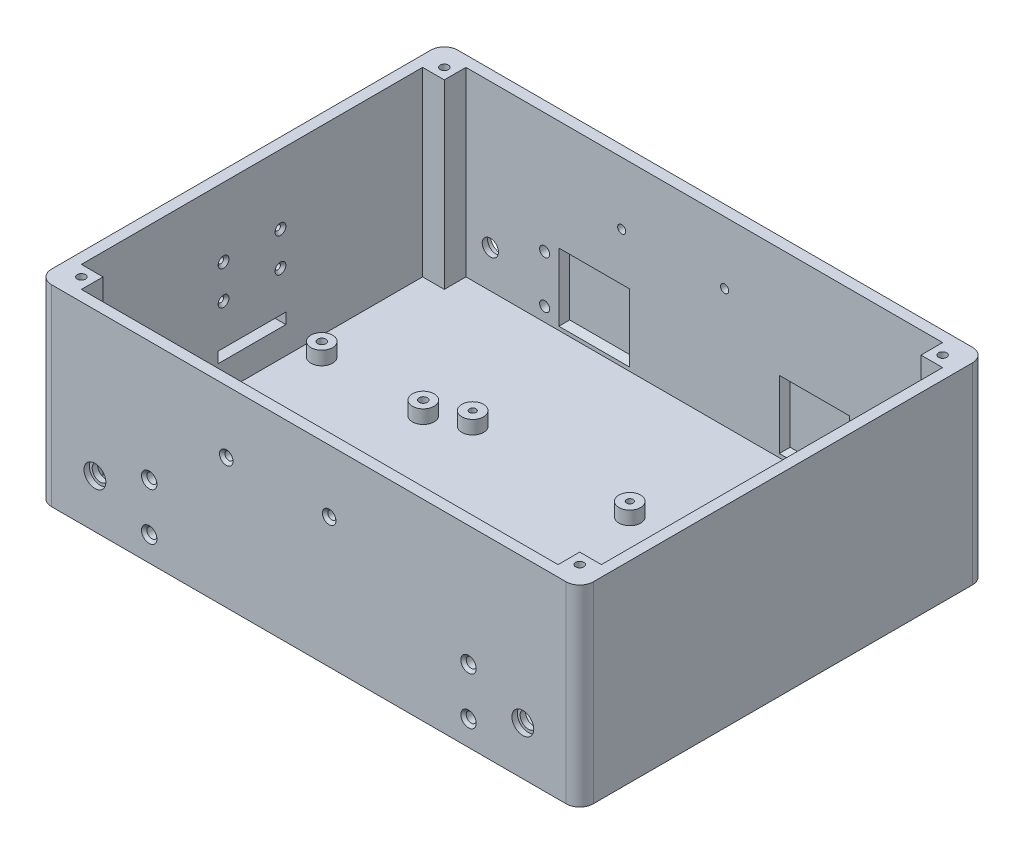
from build123d import *

# Parameters (mm, degrees)
SZKIC2_W                        = 200
SZKIC2_H                        = 150
DODANIE_WYCI_GNI_CIE1_DEPTH     = 41
SKORUPA1_T                      = -4
WYTNIJ_WYCI_GNI_CIE2_DEPTH      = 167
WYTNIJ_WYCI_GNI_CIE2_DEPTH_BACK = 15
SZKIC3_R                        = 3
SZKIC3_R_2                      = 1.85
SZKIC4_R                        = 4.035
WYTNIJ_WYCI_GNI_CIE3_DEPTH      = 2
WYTNIJ_WYCI_GNI_CIE4_START      = -2
SZKIC5_R                        = 4.035
WYTNIJ_WYCI_GNI_CIE4_DEPTH      = 2
SZKIC6_R                        = 4
DODANIE_WYCI_GNI_CIE2_DEPTH     = 5
SZKIC7_R                        = 1.2
WYTNIJ_WYCI_GNI_CIE5_DEPTH      = 10
SZKIC9_W                        = 26
SZKIC9_H                        = 25
WYTNIJ_WYCI_GNI_CIE7_DEPTH      = 2
WYTNIJ_WYCI_GNI_CIE7_DRAFT      = -45
SZKIC10_W                       = 26
SZKIC10_H                       = 25
WYTNIJ_WYCI_GNI_CIE8_DEPTH      = 2
WYTNIJ_WYCI_GNI_CIE8_DRAFT      = -45
SZKIC11_W                       = 26
SZKIC11_H                       = 25
WYTNIJ_WYCI_GNI_CIE9_DEPTH      = 2
WYTNIJ_WYCI_GNI_CIE9_DRAFT      = -45
SZKIC12_W                       = 26
SZKIC12_H                       = 25
WYTNIJ_WYCI_GNI_CIE10_DEPTH     = 2
WYTNIJ_WYCI_GNI_CIE10_DRAFT     = -45
SZKIC13_R                       = 4
DODANIE_WYCI_GNI_CIE3_DEPTH     = 5
SZKIC14_R                       = 1.5
WYTNIJ_WYCI_GNI_CIE11_DEPTH     = 20
SZKIC15_W                       = 200
SZKIC15_H                       = 150
SZKIC15_W_2                     = 192
SZKIC15_H_2                     = 142
DODANIE_WYCI_GNI_CIE4_DEPTH     = 30
SZKIC18_R                       = 1.5
WYTNIJ_WYCI_GNI_CIE12_DEPTH     = 170
SFAZOWANIE4_SIZE                = 1
ZAOKR_GLENIE2_R                 = 5
ZAOKR_GLENIE3_R                 = 5
ZAOKR_GLENIE4_R                 = 5
ZAOKR_GLENIE5_R                 = 5
SZKIC20_W                       = 25
SZKIC20_H                       = 4
WYTNIJ_WYCI_GNI_CIE13_DEPTH     = 10
SZKIC21_W                       = 8
SZKIC21_H                       = 8
SZKIC21_R                       = 1.5
DODANIE_WYCI_GNI_CIE5_DEPTH     = 67
SZKIC22_R                       = 4
DODANIE_WYCI_GNI_CIE6_DEPTH     = 5
SZKIC23_R                       = 1.5
WYTNIJ_WYCI_GNI_CIE14_DEPTH     = 10
SZKIC24_R                       = 1
WYTNIJ_WYCI_GNI_CIE15_DEPTH     = 5
SFAZOWANIE5_SIZE                = 1


with BuildPart() as part:
    # Szkic2 → Dodanie-wyciągnięcie1 (new body)
    with BuildSketch(Plane(origin=(0, 0, 0), x_dir=(1, 0, 0), z_dir=(0, 1, 0))):
        Rectangle(SZKIC2_W, SZKIC2_H)
    extrude(amount=DODANIE_WYCI_GNI_CIE1_DEPTH)

    # Skorupa1
    skorupa1_openings = [part.faces().sort_by_distance(p)[0] for p in [
        (0, 41, 0),
    ]]
    offset(amount=SKORUPA1_T, openings=skorupa1_openings, kind=Kind.INTERSECTION)

    # Szkic3 → Wytnij-wyciągnięcie2 (cut, two sides: drawn at the far end of the back side and taken through both)
    with BuildSketch(Plane.XY.offset(-71).offset(-WYTNIJ_WYCI_GNI_CIE2_DEPTH_BACK)):
        with Locations(Location((-79, 17.875, 0), (0, 0, 180))):
            Circle(SZKIC3_R)
        with Locations(Location((-58.95, 26.625, 0), (0, 0, 180))):
            Circle(SZKIC3_R_2)
        with Locations(Location((-58.95, 9.125, 0), (0, 0, 180))):
            Circle(SZKIC3_R_2)
        with Locations(Location((79, 17.875, 0), (0, 0, 180))):
            Circle(SZKIC3_R)
        with Locations(Location((58.95, 26.625, 0), (0, 0, 180))):
            Circle(SZKIC3_R_2)
        with Locations(Location((58.95, 9.125, 0), (0, 0, 180))):
            Circle(SZKIC3_R_2)
    extrude(amount=WYTNIJ_WYCI_GNI_CIE2_DEPTH + WYTNIJ_WYCI_GNI_CIE2_DEPTH_BACK, mode=Mode.SUBTRACT)

    # Szkic4 → Wytnij-wyciągnięcie3 (cut)
    with BuildSketch(Plane(origin=(0, 0, -75), x_dir=(-1, 0, 0), z_dir=(0, 0, -1))):
        with Locations((-79, 17.875)):
            Circle(SZKIC4_R)
        with Locations((79, 17.875)):
            Circle(SZKIC4_R)
    extrude(amount=-WYTNIJ_WYCI_GNI_CIE3_DEPTH, mode=Mode.SUBTRACT)

    # Szkic5 → Wytnij-wyciągnięcie4 (cut)
    with BuildSketch(Plane.XY.offset(75).offset(WYTNIJ_WYCI_GNI_CIE4_START)):
        with Locations(Location((79, 17.875, 0), (0, 0, 180))):
            Circle(SZKIC5_R)
        with Locations(Location((-79, 17.875, 0), (0, 0, 180))):
            Circle(SZKIC5_R)
    extrude(amount=WYTNIJ_WYCI_GNI_CIE4_DEPTH, mode=Mode.SUBTRACT)

    # Szkic6 → Dodanie-wyciągnięcie2 (add)
    with BuildSketch(Plane(origin=(0, 4, 0), x_dir=(1, 0, 0), z_dir=(0, 1, 0))):
        with Locations(Location((19, -24.5, 0), (0, 0, 270))):
            Circle(SZKIC6_R)
        with Locations(Location((19, 24.5, 0), (0, 0, 270))):
            Circle(SZKIC6_R)
        with Locations(Location((-39, 24.5, 0), (0, 0, 270))):
            Circle(SZKIC6_R)
        with Locations(Location((-39, -24.5, 0), (0, 0, 270))):
            Circle(SZKIC6_R)
    extrude(amount=DODANIE_WYCI_GNI_CIE2_DEPTH)

    # Szkic7 → Wytnij-wyciągnięcie5 (cut)
    with BuildSketch(Plane(origin=(0, 9, 0), x_dir=(1, 0, 0), z_dir=(0, 1, 0))):
        with Locations(Location((-39, 24.5, 0), (0, 0, 270))):
            Circle(SZKIC7_R)
        with Locations(Location((19, 24.5, 0), (0, 0, 270))):
            Circle(SZKIC7_R)
        with Locations(Location((19, -24.5, 0), (0, 0, 270))):
            Circle(SZKIC7_R)
        with Locations(Location((-39, -24.5, 0), (0, 0, 270))):
            Circle(SZKIC7_R)
    extrude(amount=-WYTNIJ_WYCI_GNI_CIE5_DEPTH, mode=Mode.SUBTRACT)


with BuildPart() as wytnij_wyci_gni_cie7_tool:
    # Szkic9 → Wytnij-wyciągnięcie7 (with draft: the straight prism first)
    with BuildSketch(Plane.XY.offset(-71)):
        with Locations((-40.7, 17.875)):
            Rectangle(SZKIC9_W, SZKIC9_H)
    extrude(amount=-WYTNIJ_WYCI_GNI_CIE7_DEPTH)
    # Wytnij-wyciągnięcie7: the draft: its side faces are tilted about the plane it starts from
    wytnij_wyci_gni_cie7_sides = [wytnij_wyci_gni_cie7_tool.faces().sort_by_distance(p)[0] for p in [
        (-53.7, 17.875, -72),
        (-40.7, 5.375, -72),
        (-27.7, 17.875, -72),
        (-40.7, 30.375, -72),
    ]]
    draft(wytnij_wyci_gni_cie7_sides, Plane.XY.offset(-71), WYTNIJ_WYCI_GNI_CIE7_DRAFT)


with BuildPart() as part_1:
    add(part.part)

    # Wytnij-wyciągnięcie7: cut by wytnij_wyci_gni_cie7_tool
    add(wytnij_wyci_gni_cie7_tool.part, mode=Mode.SUBTRACT)


with BuildPart() as wytnij_wyci_gni_cie8_tool:
    # Szkic10 → Wytnij-wyciągnięcie8 (with draft: the straight prism first)
    with BuildSketch(Plane.XY.offset(-71)):
        with Locations((40.7, 17.875)):
            Rectangle(SZKIC10_W, SZKIC10_H)
    extrude(amount=-WYTNIJ_WYCI_GNI_CIE8_DEPTH)
    # Wytnij-wyciągnięcie8: the draft: its side faces are tilted about the plane it starts from
    wytnij_wyci_gni_cie8_sides = [wytnij_wyci_gni_cie8_tool.faces().sort_by_distance(p)[0] for p in [
        (40.7, 30.375, -72),
        (27.7, 17.875, -72),
        (40.7, 5.375, -72),
        (53.7, 17.875, -72),
    ]]
    draft(wytnij_wyci_gni_cie8_sides, Plane.XY.offset(-71), WYTNIJ_WYCI_GNI_CIE8_DRAFT)


with BuildPart() as part_2:
    add(part_1.part)

    # Wytnij-wyciągnięcie8: cut by wytnij_wyci_gni_cie8_tool
    add(wytnij_wyci_gni_cie8_tool.part, mode=Mode.SUBTRACT)


with BuildPart() as wytnij_wyci_gni_cie9_tool:
    # Szkic11 → Wytnij-wyciągnięcie9 (with draft: the straight prism first)
    with BuildSketch(Plane(origin=(0, 0, 71), x_dir=(-1, 0, 0), z_dir=(0, 0, -1))):
        with Locations((40.7, 17.875)):
            Rectangle(SZKIC11_W, SZKIC11_H)
    extrude(amount=-WYTNIJ_WYCI_GNI_CIE9_DEPTH)
    # Wytnij-wyciągnięcie9: the draft: its side faces are tilted about the plane it starts from
    wytnij_wyci_gni_cie9_sides = [wytnij_wyci_gni_cie9_tool.faces().sort_by_distance(p)[0] for p in [
        (-40.7, 30.375, 72),
        (-27.7, 17.875, 72),
        (-40.7, 5.375, 72),
        (-53.7, 17.875, 72),
    ]]
    draft(wytnij_wyci_gni_cie9_sides, Plane(origin=(0, 0, 71), x_dir=(-1, 0, 0), z_dir=(0, 0, -1)), WYTNIJ_WYCI_GNI_CIE9_DRAFT)


with BuildPart() as part_3:
    add(part_2.part)

    # Wytnij-wyciągnięcie9: cut by wytnij_wyci_gni_cie9_tool
    add(wytnij_wyci_gni_cie9_tool.part, mode=Mode.SUBTRACT)


with BuildPart() as wytnij_wyci_gni_cie10_tool:
    # Szkic12 → Wytnij-wyciągnięcie10 (with draft: the straight prism first)
    with BuildSketch(Plane(origin=(0, 0, 71), x_dir=(-1, 0, 0), z_dir=(0, 0, -1))):
        with Locations((-40.7, 17.875)):
            Rectangle(SZKIC12_W, SZKIC12_H)
    extrude(amount=-WYTNIJ_WYCI_GNI_CIE10_DEPTH)
    # Wytnij-wyciągnięcie10: the draft: its side faces are tilted about the plane it starts from
    wytnij_wyci_gni_cie10_sides = [wytnij_wyci_gni_cie10_tool.faces().sort_by_distance(p)[0] for p in [
        (53.7, 17.875, 72),
        (40.7, 5.375, 72),
        (27.7, 17.875, 72),
        (40.7, 30.375, 72),
    ]]
    draft(wytnij_wyci_gni_cie10_sides, Plane(origin=(0, 0, 71), x_dir=(-1, 0, 0), z_dir=(0, 0, -1)), WYTNIJ_WYCI_GNI_CIE10_DRAFT)


with BuildPart() as part_4:
    add(part_3.part)

    # Wytnij-wyciągnięcie10: cut by wytnij_wyci_gni_cie10_tool
    add(wytnij_wyci_gni_cie10_tool.part, mode=Mode.SUBTRACT)

    # Szkic13 → Dodanie-wyciągnięcie3 (add)
    with BuildSketch(Plane(origin=(0, 4, 0), x_dir=(1, 0, 0), z_dir=(0, 1, 0))):
        with Locations(Location((-51.5, 18.75, 0), (0, 0, 270))):
            Circle(SZKIC13_R)
        with Locations(Location((-89, 18.75, 0), (0, 0, 270))):
            Circle(SZKIC13_R)
        with Locations(Location((-89, -18.75, 0), (0, 0, 270))):
            Circle(SZKIC13_R)
        with Locations(Location((-51.5, -18.75, 0), (0, 0, 270))):
            Circle(SZKIC13_R)
    extrude(amount=DODANIE_WYCI_GNI_CIE3_DEPTH)

    # Szkic14 → Wytnij-wyciągnięcie11 (cut)
    with BuildSketch(Plane(origin=(0, 9, 0), x_dir=(1, 0, 0), z_dir=(0, 1, 0))):
        with Locations(Location((-51.5, 18.75, 0), (0, 0, 270))):
            Circle(SZKIC14_R)
        with Locations(Location((-89, 18.75, 0), (0, 0, 270))):
            Circle(SZKIC14_R)
        with Locations(Location((-89, -18.75, 0), (0, 0, 270))):
            Circle(SZKIC14_R)
        with Locations(Location((-51.5, -18.75, 0), (0, 0, 270))):
            Circle(SZKIC14_R)
    extrude(amount=-WYTNIJ_WYCI_GNI_CIE11_DEPTH, mode=Mode.SUBTRACT)

    # Szkic15 → Dodanie-wyciągnięcie4 (add)
    with BuildSketch(Plane(origin=(0, 41, 0), x_dir=(1, 0, 0), z_dir=(0, 1, 0))):
        Rectangle(SZKIC15_W, SZKIC15_H)
        Rectangle(SZKIC15_W_2, SZKIC15_H_2, mode=Mode.SUBTRACT)
    extrude(amount=DODANIE_WYCI_GNI_CIE4_DEPTH)

    # Szkic18 → Wytnij-wyciągnięcie12 (cut)
    with BuildSketch(Plane(origin=(0, 0, -75), x_dir=(-1, 0, 0), z_dir=(0, 0, -1))):
        with Locations((30.5, 48)):
            Circle(SZKIC18_R)
        with Locations((-7.5, 48)):
            Circle(SZKIC18_R)
    extrude(amount=-WYTNIJ_WYCI_GNI_CIE12_DEPTH, mode=Mode.SUBTRACT)

    # Sfazowanie4
    sfazowanie4_edges = [part_4.edges().sort_by_distance(p)[0] for p in [
        (-29, 48, 75),
        (-29, 48, -75),
        (9, 48, 75),
        (9, 48, -75),
        (60.8, 9.125, -75),
        (60.8, 9.125, 75),
        (60.8, 26.625, -75),
        (60.8, 26.625, 75),
        (-57.1, 9.125, -75),
        (-57.1, 9.125, 75),
        (-57.1, 26.625, -75),
        (-57.1, 26.625, 75),
    ]]
    chamfer(sfazowanie4_edges, length=SFAZOWANIE4_SIZE)

    # Zaokrąglenie2
    zaokr_glenie2_edges = [part_4.edges().sort_by_distance(p)[0] for p in [
        (-100, 35.5, 75),
    ]]
    fillet(zaokr_glenie2_edges, radius=ZAOKR_GLENIE2_R)

    # Zaokrąglenie3
    zaokr_glenie3_edges = [part_4.edges().sort_by_distance(p)[0] for p in [
        (-100, 35.5, -75),
    ]]
    fillet(zaokr_glenie3_edges, radius=ZAOKR_GLENIE3_R)

    # Zaokrąglenie4
    zaokr_glenie4_edges = [part_4.edges().sort_by_distance(p)[0] for p in [
        (100, 35.5, -75),
    ]]
    fillet(zaokr_glenie4_edges, radius=ZAOKR_GLENIE4_R)

    # Zaokrąglenie5
    zaokr_glenie5_edges = [part_4.edges().sort_by_distance(p)[0] for p in [
        (100, 35.5, 75),
    ]]
    fillet(zaokr_glenie5_edges, radius=ZAOKR_GLENIE5_R)

    # Szkic20 → Wytnij-wyciągnięcie13 (cut)
    with BuildSketch(Plane.ZY.offset(100)):
        with Locations((0, 16)):
            Rectangle(SZKIC20_W, SZKIC20_H)
    extrude(amount=-WYTNIJ_WYCI_GNI_CIE13_DEPTH, mode=Mode.SUBTRACT)

    # Szkic21 → Dodanie-wyciągnięcie5 (add)
    # profile 1 of 4: a face of its own
    with BuildSketch(Plane(origin=(0, 4, 0), x_dir=(1, 0, 0), z_dir=(0, 1, 0))):
        with Locations((-92, 67)):
            Rectangle(SZKIC21_W, SZKIC21_H)
        with Locations(Location((-92, 67, 0), (0, 0, 270))):
            Circle(SZKIC21_R, mode=Mode.SUBTRACT)
    # profile 2 of 4: a face of its own
    with BuildSketch(Plane(origin=(0, 4, 0), x_dir=(1, 0, 0), z_dir=(0, 1, 0))):
        with Locations((-92, -67)):
            Rectangle(SZKIC21_W, SZKIC21_H)
        with Locations(Location((-92, -67, 0), (0, 0, 270))):
            Circle(SZKIC21_R, mode=Mode.SUBTRACT)
    # profile 3 of 4: a face of its own
    with BuildSketch(Plane(origin=(0, 4, 0), x_dir=(1, 0, 0), z_dir=(0, 1, 0))):
        with Locations((92, -67)):
            Rectangle(SZKIC21_W, SZKIC21_H)
        with Locations(Location((92, -67, 0), (0, 0, 270))):
            Circle(SZKIC21_R, mode=Mode.SUBTRACT)
    # profile 4 of 4: a face of its own
    with BuildSketch(Plane(origin=(0, 4, 0), x_dir=(1, 0, 0), z_dir=(0, 1, 0))):
        with Locations((92, 67)):
            Rectangle(SZKIC21_W, SZKIC21_H)
        with Locations(Location((92, 67, 0), (0, 0, 270))):
            Circle(SZKIC21_R, mode=Mode.SUBTRACT)
    extrude(amount=DODANIE_WYCI_GNI_CIE5_DEPTH)

    # Szkic22 → Dodanie-wyciągnięcie6 (add)
    with BuildSketch(Plane(origin=(0, 4, 0), x_dir=(1, 0, 0), z_dir=(0, 1, 0))):
        with Locations(Location((89, 18.75, 0), (0, 0, 270))):
            Circle(SZKIC22_R)
        with Locations(Location((51.5, 18.75, 0), (0, 0, 270))):
            Circle(SZKIC22_R)
        with Locations(Location((51.5, -18.75, 0), (0, 0, 270))):
            Circle(SZKIC22_R)
        with Locations(Location((89, -18.75, 0), (0, 0, 270))):
            Circle(SZKIC22_R)
    extrude(amount=DODANIE_WYCI_GNI_CIE6_DEPTH)

    # Szkic23 → Wytnij-wyciągnięcie14 (cut)
    with BuildSketch(Plane(origin=(0, 9, 0), x_dir=(1, 0, 0), z_dir=(0, 1, 0))):
        with Locations(Location((51.5, 18.75, 0), (0, 0, 270))):
            Circle(SZKIC23_R)
        with Locations(Location((89, 18.75, 0), (0, 0, 270))):
            Circle(SZKIC23_R)
        with Locations(Location((51.5, -18.75, 0), (0, 0, 270))):
            Circle(SZKIC23_R)
        with Locations(Location((89, -18.75, 0), (0, 0, 270))):
            Circle(SZKIC23_R)
    extrude(amount=-WYTNIJ_WYCI_GNI_CIE14_DEPTH, mode=Mode.SUBTRACT)

    # Szkic24 → Wytnij-wyciągnięcie15 (cut)
    with BuildSketch(Plane.ZY.offset(100)):
        with Locations((-10.5, 33)):
            Circle(SZKIC24_R)
        with Locations((-10.5, 45.5)):
            Circle(SZKIC24_R)
        with Locations((10.5, 45.5)):
            Circle(SZKIC24_R)
        with Locations((10.5, 33)):
            Circle(SZKIC24_R)
    extrude(amount=-WYTNIJ_WYCI_GNI_CIE15_DEPTH, mode=Mode.SUBTRACT)

    # Sfazowanie5
    sfazowanie5_edges = [part_4.edges().sort_by_distance(p)[0] for p in [
        (-96, 33, 9.5),
        (-96, 45.5, 9.5),
        (-96, 45.5, -11.5),
        (-96, 33, -11.5),
    ]]
    chamfer(sfazowanie5_edges, length=SFAZOWANIE5_SIZE)


solid = part_4.part
